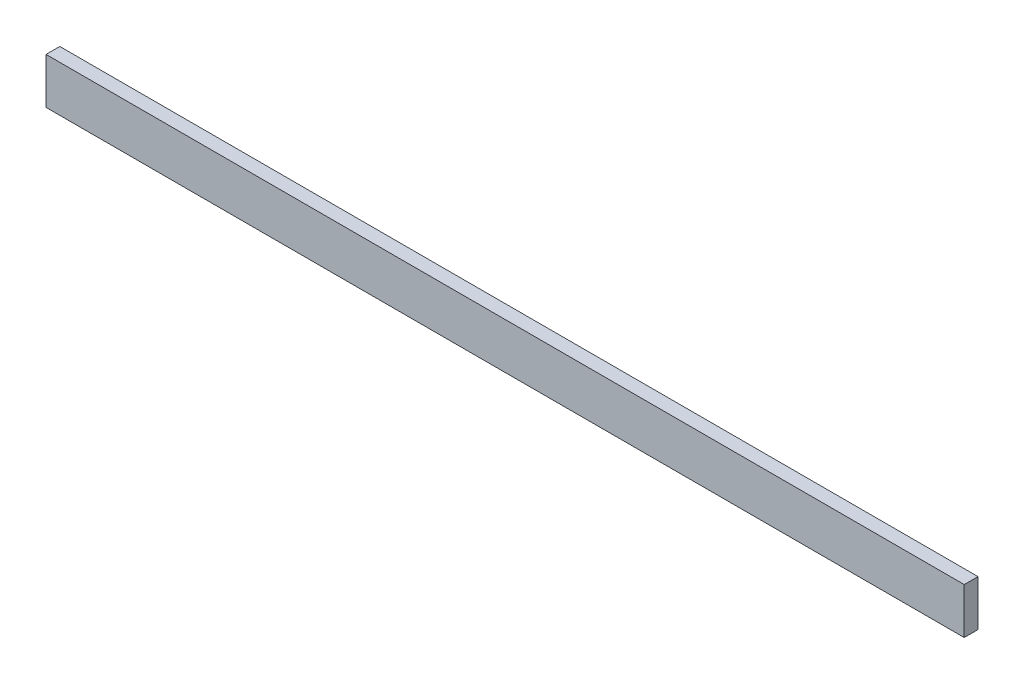
from build123d import *

# Parameters (mm, degrees)
ESQUISSE1_W        = 200
ESQUISSE1_H        = 10
BOSS_EXTRU_1_DEPTH = 3


with BuildPart() as part:
    # Esquisse1 → Boss.-Extru.1 (new body)
    with BuildSketch(Plane.XY):
        with Locations((100, 5)):
            Rectangle(ESQUISSE1_W, ESQUISSE1_H)
    extrude(amount=BOSS_EXTRU_1_DEPTH)


solid = part.part
